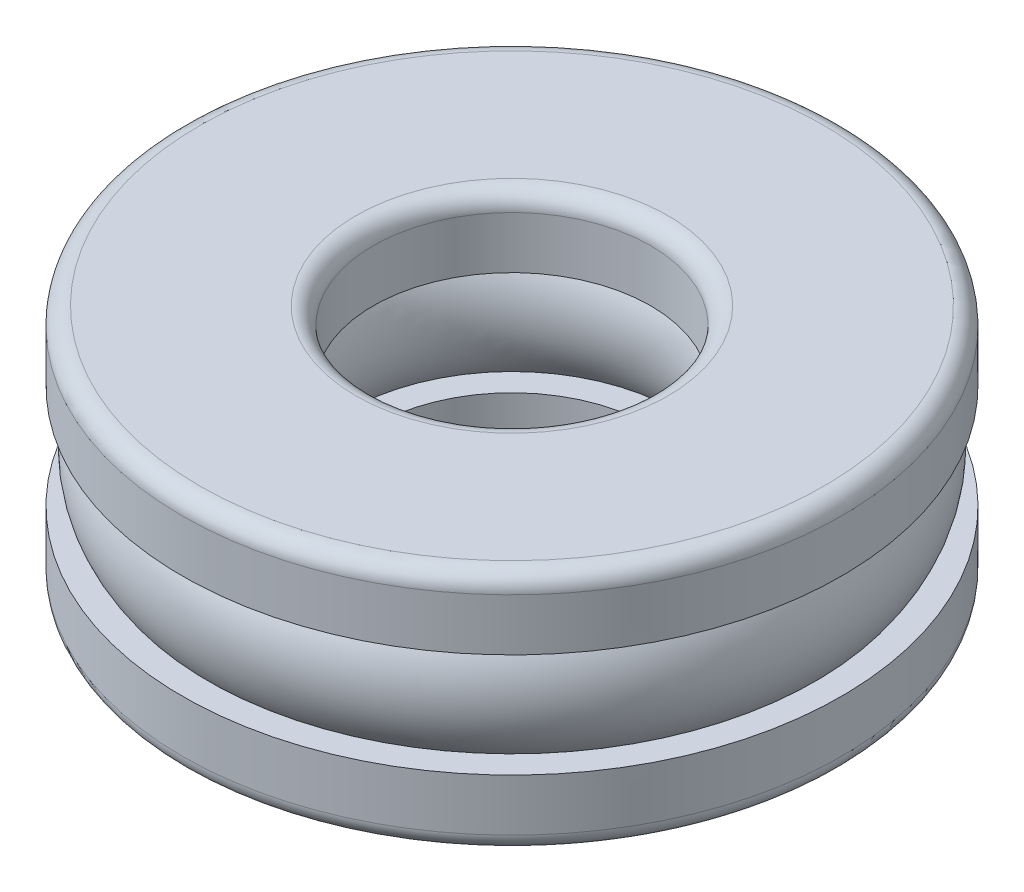
from build123d import *
from build123d.topology import SkipClean

# Parameters (mm, degrees)
ESBO_O1_R = 2.5
ESBO_O1_W = 5.5
ESBO_O1_H = 2
FILETE1_R = 0.5


with BuildPart() as part:
    # Esboço1 → Revolução1 (revolve)
    with SkipClean():  # the faces are left unmerged after this step: merging them gives an invalid solid
        with BuildSketch(Plane.XY, mode=Mode.PRIVATE) as revolu_o1_sk:
            with Locations((-6.75, 0)):
                Circle(ESBO_O1_R)
            with Locations((-6.75, 2.5)):
                Rectangle(ESBO_O1_W, ESBO_O1_H)
            with BuildLine():
                ThreePointArc((-4.75, 1.5), (-6.75, 2.5), (-8.75, 1.5))
                Line((-8.75, 1.5), (-4.75, 1.5))
            make_face()
            with BuildLine():
                Line((-4.75, 1.5), (-8.75, 1.5))
                ThreePointArc((-8.75, 1.5), (-9.25, 0), (-8.75, -1.5))
                Line((-8.75, -1.5), (-4.75, -1.5))
                ThreePointArc((-4.75, -1.5), (-4.378291755, -0.790569415), (-4.25, 0))
                ThreePointArc((-4.25, 0), (-4.378291755, 0.790569415), (-4.75, 1.5))
            make_face()
            with BuildLine():
                Line((-4.75, -1.5), (-8.75, -1.5))
                ThreePointArc((-8.75, -1.5), (-6.75, -2.5), (-4.75, -1.5))
            make_face()
            with Locations((-6.75, -2.5)):
                Rectangle(ESBO_O1_W, ESBO_O1_H)
        revolve(revolu_o1_sk.sketch.rotate(Axis((0, 0, 0), (0, 1, 0)), 270), axis=Axis((0, 0, 0), (0, 1, 0)))

    # Filete1
    filete1_edges = [part.edges().sort_by_distance(p)[0] for p in [
        (0, 3.5, 4),
        (0, -3.5, 4),
        (0, -3.5, 9.5),
        (0, 3.5, 9.5),
    ]]
    fillet(filete1_edges, radius=FILETE1_R)


solid = part.part
